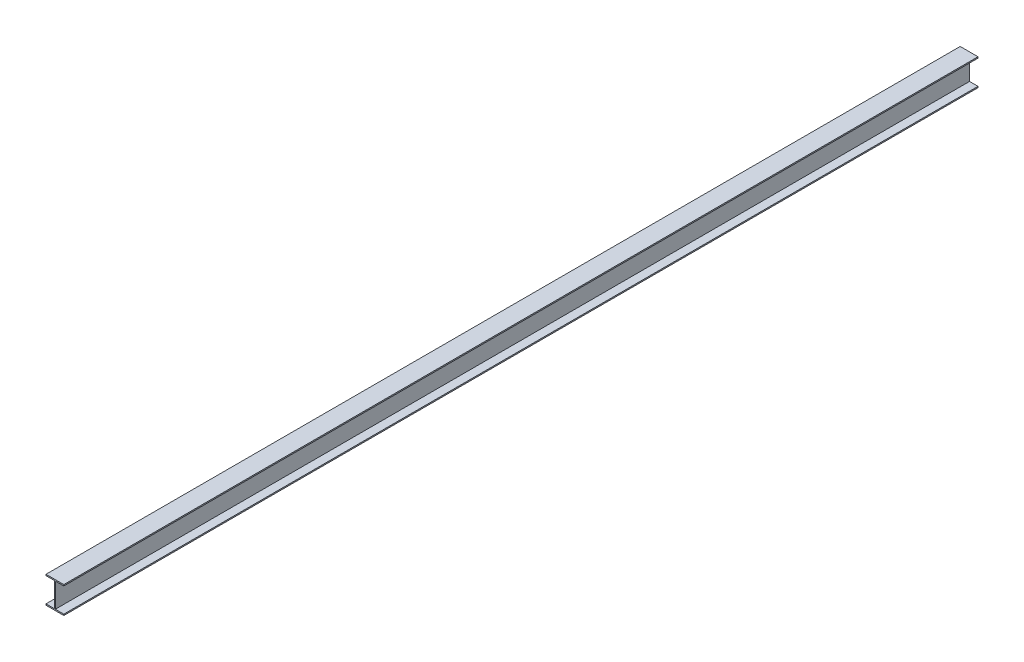
from build123d import *

# Parameters (mm, degrees)
BOSS_EXTRUDE1_DEPTH = 5214.4


with BuildPart() as part:
    # Sketch1 → Boss-Extrude1 (new body)
    with BuildSketch(Plane.XY):
        Polygon((0, -0.000240533), (101.6, -0.000240533), (101.6, -7.112240533), (53.408035714, -7.112240533), (53.408035714, -146.050240533), (101.6, -146.050240533), (101.6, -153.162240533), (0, -153.162240533), (0, -146.050240533), (47.566035714, -146.050240533), (47.566035714, -7.112240533), (0, -7.112240533), align=None)
    extrude(amount=BOSS_EXTRUDE1_DEPTH)


solid = part.part
